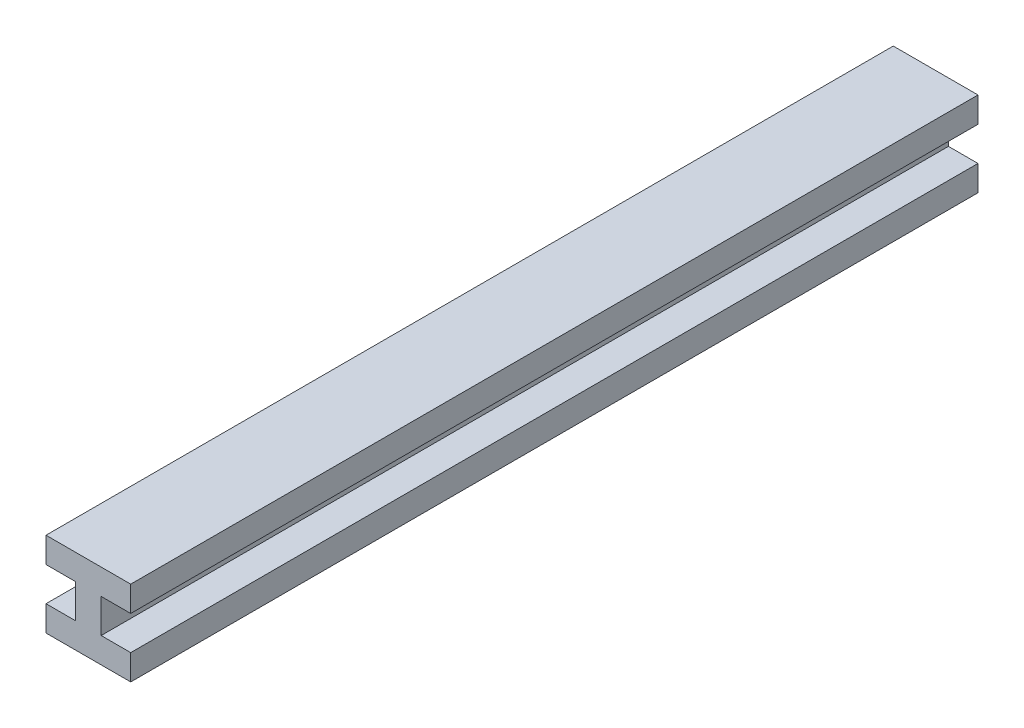
from build123d import *

# Parameters (mm, degrees)
BOSS_EXTRUDE1_DEPTH = 100


with BuildPart() as part:
    # Sketch1 → Boss-Extrude1 (new body)
    with BuildSketch(Plane.XY):
        Polygon((5, 0), (-5, 0), (-5, 3), (-1.510791367, 3), (-1.510791367, 7), (-5, 7), (-5, 10), (5, 10), (5, 7), (1.510791367, 7), (1.510791367, 3), (5, 3), align=None)
    extrude(amount=BOSS_EXTRUDE1_DEPTH)


solid = part.part
